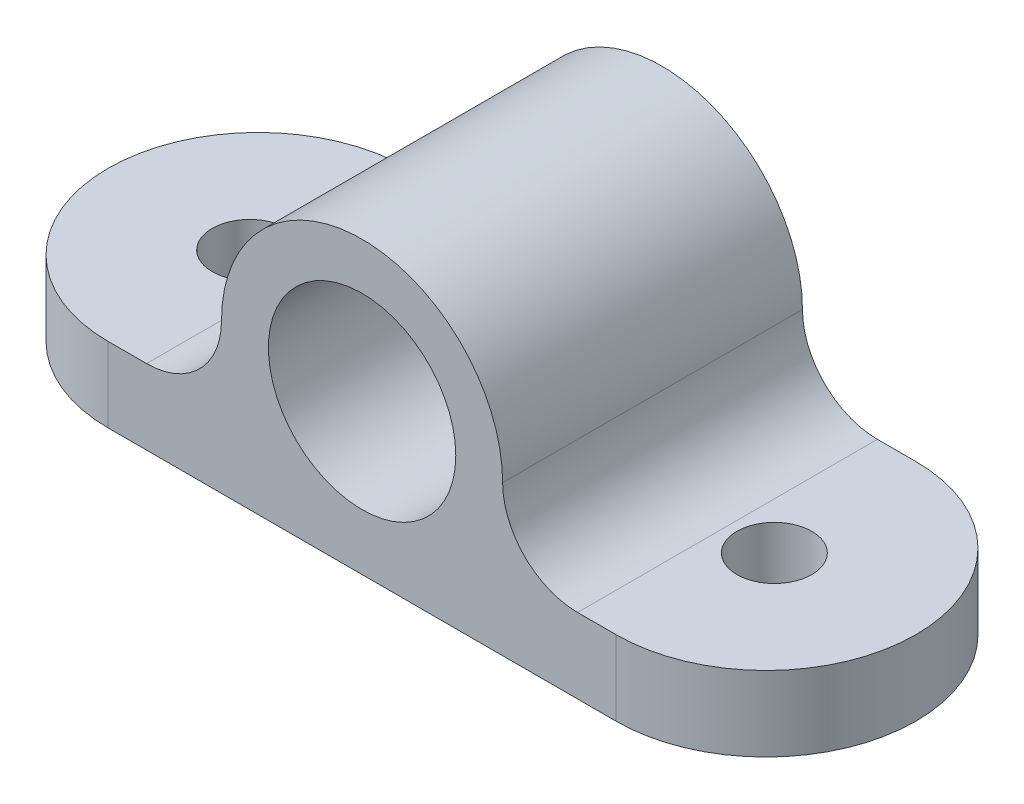
from build123d import *

# Parameters (mm, degrees)
SKETCH1_R           = 25
BOSS_EXTRUDE1_DEPTH = 80
CUT_EXTRUDE1_DEPTH  = 80
SKETCH3_R           = 10
CUT_EXTRUDE2_DEPTH  = 80


with BuildPart() as part:
    # Sketch1 → Boss-Extrude1 (new body)
    with BuildSketch(Plane.XY):
        with BuildLine():
            Line((-107.76864352, 0), (107.76864352, 0))
            Line((107.76864352, 0), (107.76864352, 20))
            Line((107.76864352, 20), (57.5, 20))
            ThreePointArc((57.5, 20), (43.357864376, 25.857864376), (37.5, 40))
            ThreePointArc((37.5, 40), (0, 77.5), (-37.5, 40))
            ThreePointArc((-37.5, 40), (-43.357864376, 25.857864376), (-57.5, 20))
            Line((-57.5, 20), (-107.76864352, 20))
            Line((-107.76864352, 20), (-107.76864352, 0))
        make_face()
        with Locations((0, 40)):
            Circle(SKETCH1_R, mode=Mode.SUBTRACT)
    extrude(amount=-BOSS_EXTRUDE1_DEPTH)

    # Sketch2 → Cut-Extrude1 (cut)
    with BuildSketch(Plane(origin=(0, 20, 0), x_dir=(1, 0, 0), z_dir=(0, 1, 0))):
        with BuildLine():
            Line((-107.76864352, 0), (-67.76864352, 0))
            ThreePointArc((-67.76864352, 0), (-96.052914767, 11.715728753), (-107.76864352, 40))
            Line((-107.76864352, 40), (-107.76864352, 0))
        make_face()
        with BuildLine():
            ThreePointArc((-107.76864352, 40), (-96.052914767, 68.284271247), (-67.76864352, 80))
            Line((-67.76864352, 80), (-107.76864352, 80))
            Line((-107.76864352, 80), (-107.76864352, 40))
        make_face()
        with BuildLine():
            ThreePointArc((107.76864352, 40), (96.052914767, 11.715728753), (67.76864352, 0))
            Line((67.76864352, 0), (107.76864352, 0))
            Line((107.76864352, 0), (107.76864352, 40))
        make_face()
        with BuildLine():
            Line((107.76864352, 80), (67.76864352, 80))
            ThreePointArc((67.76864352, 80), (96.052914767, 68.284271247), (107.76864352, 40))
            Line((107.76864352, 40), (107.76864352, 80))
        make_face()
    extrude(amount=-CUT_EXTRUDE1_DEPTH, mode=Mode.SUBTRACT)

    # Sketch3 → Cut-Extrude2 (cut)
    with BuildSketch(Plane(origin=(0, 20, 0), x_dir=(1, 0, 0), z_dir=(0, 1, 0))):
        with Locations(Location((70, 40, 0), (0, 0, 270))):
            Circle(SKETCH3_R)
        with Locations(Location((-70, 40, 0), (0, 0, 270))):
            Circle(SKETCH3_R)
    extrude(amount=-CUT_EXTRUDE2_DEPTH, mode=Mode.SUBTRACT)


solid = part.part
